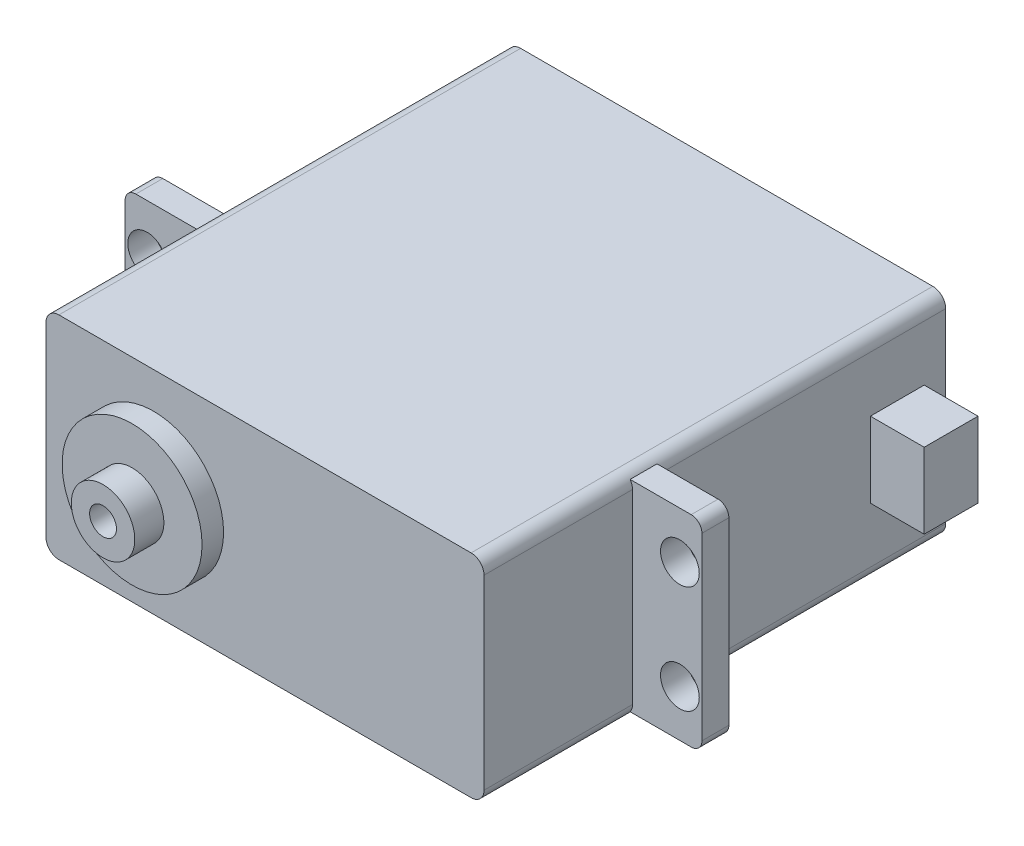
from build123d import *

# Parameters (mm, degrees)
CASE_START   = -42.9
CASE_2_DEPTH = 42.9
TABS_START   = -16.3
SKETCH2_R    = 1.8
TABS_DEPTH   = 2.5
SKETCH3_R    = 6.5
BOSS_DEPTH   = 2
SPLINE_START = 2
SKETCH4_R    = 2.95
SPLINE_DEPTH = 2.7
M3_START     = 0.7
SKETCH5_R    = 1.25
M3_TAP_DEPTH = 4.1
LEAD_START   = 30.5
SKETCH6_W    = 5
SKETCH6_H    = 7
LEAD_DEPTH   = 5.2


with BuildPart() as part:
    # Sketch1 → Case 2 (new body)
    with BuildSketch(Plane.XY.offset(CASE_START)):
        with BuildLine():
            Line((-8.8, -9.85), (29.5, -9.85))
            ThreePointArc((29.5, -9.85), (30.348528137, -9.498528137), (30.7, -8.65))
            Line((30.7, -8.65), (30.7, 8.65))
            ThreePointArc((30.7, 8.65), (30.348528137, 9.498528137), (29.5, 9.85))
            Line((29.5, 9.85), (-8.8, 9.85))
            ThreePointArc((-8.8, 9.85), (-9.648528137, 9.498528137), (-10, 8.65))
            Line((-10, 8.65), (-10, -8.65))
            ThreePointArc((-10, -8.65), (-9.648528137, -9.498528137), (-8.8, -9.85))
        make_face()
    extrude(amount=CASE_2_DEPTH)

    # Sketch2 → Tabs (add)
    with BuildSketch(Plane.XY.offset(TABS_START)):
        with BuildLine():
            Line((-15.45, -9.35), (36.15, -9.35))
            ThreePointArc((36.15, -9.35), (36.857106781, -9.057106781), (37.15, -8.35))
            Line((37.15, -8.35), (37.15, 8.35))
            ThreePointArc((37.15, 8.35), (36.857106781, 9.057106781), (36.15, 9.35))
            Line((36.15, 9.35), (-15.45, 9.35))
            ThreePointArc((-15.45, 9.35), (-16.157106781, 9.057106781), (-16.45, 8.35))
            Line((-16.45, 8.35), (-16.45, -8.35))
            ThreePointArc((-16.45, -8.35), (-16.157106781, -9.057106781), (-15.45, -9.35))
        make_face()
        with Locations((-14.4, -5)):
            Circle(SKETCH2_R, mode=Mode.SUBTRACT)
        with Locations((-14.4, 5)):
            Circle(SKETCH2_R, mode=Mode.SUBTRACT)
        with Locations((35.1, -5)):
            Circle(SKETCH2_R, mode=Mode.SUBTRACT)
        with Locations((35.1, 5)):
            Circle(SKETCH2_R, mode=Mode.SUBTRACT)
    extrude(amount=TABS_DEPTH)

    # Sketch3 → Boss (add)
    with BuildSketch(Plane.XY):
        Circle(SKETCH3_R)
    extrude(amount=BOSS_DEPTH)

    # Sketch4 → Spline (add)
    with BuildSketch(Plane.XY.offset(SPLINE_START)):
        with Locations(Location((0, 0, 0), (0, 0, 180))):
            Circle(SKETCH4_R)
    extrude(amount=SPLINE_DEPTH)

    # Sketch5 → M3 tap (cut)
    with BuildSketch(Plane.XY.offset(M3_START)):
        Circle(SKETCH5_R)
    extrude(amount=M3_TAP_DEPTH, mode=Mode.SUBTRACT)

    # Sketch6 → Lead (add)
    with BuildSketch(Plane(origin=(0, 0, 0), x_dir=(0, 0, -1), z_dir=(1, 0, 0)).offset(LEAD_START)):
        with Locations((38.4, 0)):
            Rectangle(SKETCH6_W, SKETCH6_H)
    extrude(amount=LEAD_DEPTH)


solid = part.part
